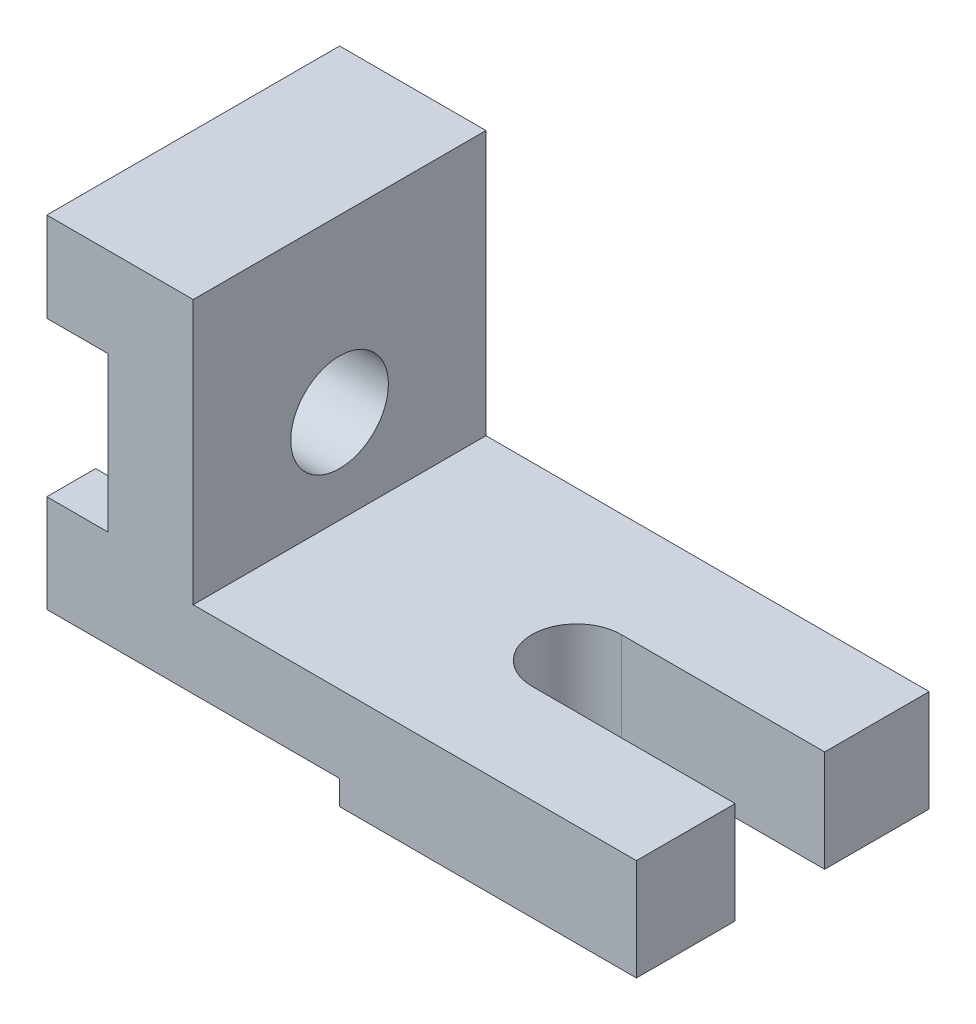
from build123d import *

# Parameters (mm, degrees)
SKETCH1_W           = 145
SKETCH1_H           = 72
BOSS_EXTRUDE1_DEPTH = 25
SKETCH2_W           = 72
SKETCH2_H           = 6
CUT_EXTRUDE1_DEPTH  = 50
CUT_EXTRUDE2_DEPTH  = 50
SKETCH4_W           = 36
SKETCH4_H           = 65
BOSS_EXTRUDE2_DEPTH = 72
SKETCH5_R           = 30
CUT_EXTRUDE3_DEPTH  = 15
SKETCH6_W           = 15
SKETCH6_H           = 38
CUT_EXTRUDE4_DEPTH  = 137.162586638
SKETCH7_R           = 12
CUT_EXTRUDE5_DEPTH  = 163.160414405


with BuildPart() as part:
    # Sketch1 → Boss-Extrude1 (new body)
    with BuildSketch(Plane(origin=(0, 0, 0), x_dir=(1, 0, 0), z_dir=(0, 1, 0))):
        Rectangle(SKETCH1_W, SKETCH1_H)
    extrude(amount=BOSS_EXTRUDE1_DEPTH)

    # Sketch2 → Cut-Extrude1 (cut)
    with BuildSketch(Plane.XY.offset(36)):
        with Locations((-36.5, 3)):
            Rectangle(SKETCH2_W, SKETCH2_H)
    extrude(amount=-CUT_EXTRUDE1_DEPTH, mode=Mode.SUBTRACT)

    # Sketch3 → Cut-Extrude2 (cut)
    with BuildSketch(Plane(origin=(0, 25, 0), x_dir=(1, 0, 0), z_dir=(0, 1, 0))):
        with BuildLine():
            Line((22.5, 10.292135336), (72.5, 10.292135336))
            Line((72.5, 10.292135336), (72.5, -11.707864664))
            Line((72.5, -11.707864664), (22.5, -11.707864664))
            ThreePointArc((22.5, -11.707864664), (11.5, -0.707864664), (22.5, 10.292135336))
        make_face()
    extrude(amount=-CUT_EXTRUDE2_DEPTH, mode=Mode.SUBTRACT)

    # Sketch4 → Boss-Extrude2 (add)
    with BuildSketch(Plane.XY.offset(36)):
        with Locations((-54.5, 57.5)):
            Rectangle(SKETCH4_W, SKETCH4_H)
    extrude(amount=-BOSS_EXTRUDE2_DEPTH)

    # Sketch5 → Cut-Extrude3 (cut)
    with BuildSketch(Plane.ZY.offset(72.5)):
        with Locations((0, 48)):
            Circle(SKETCH5_R)
    extrude(amount=-CUT_EXTRUDE3_DEPTH, mode=Mode.SUBTRACT)

    # Sketch6 → Cut-Extrude4 (cut, through all)
    with BuildSketch(Plane.XY.offset(36)):
        with Locations((-65, 49)):
            Rectangle(SKETCH6_W, SKETCH6_H)
    extrude(amount=-CUT_EXTRUDE4_DEPTH, mode=Mode.SUBTRACT)

    # Sketch7 → Cut-Extrude5 (cut, through all)
    with BuildSketch(Plane.ZY.offset(57.5)):
        with Locations((0, 48)):
            Circle(SKETCH7_R)
    extrude(amount=-CUT_EXTRUDE5_DEPTH, mode=Mode.SUBTRACT)


solid = part.part
